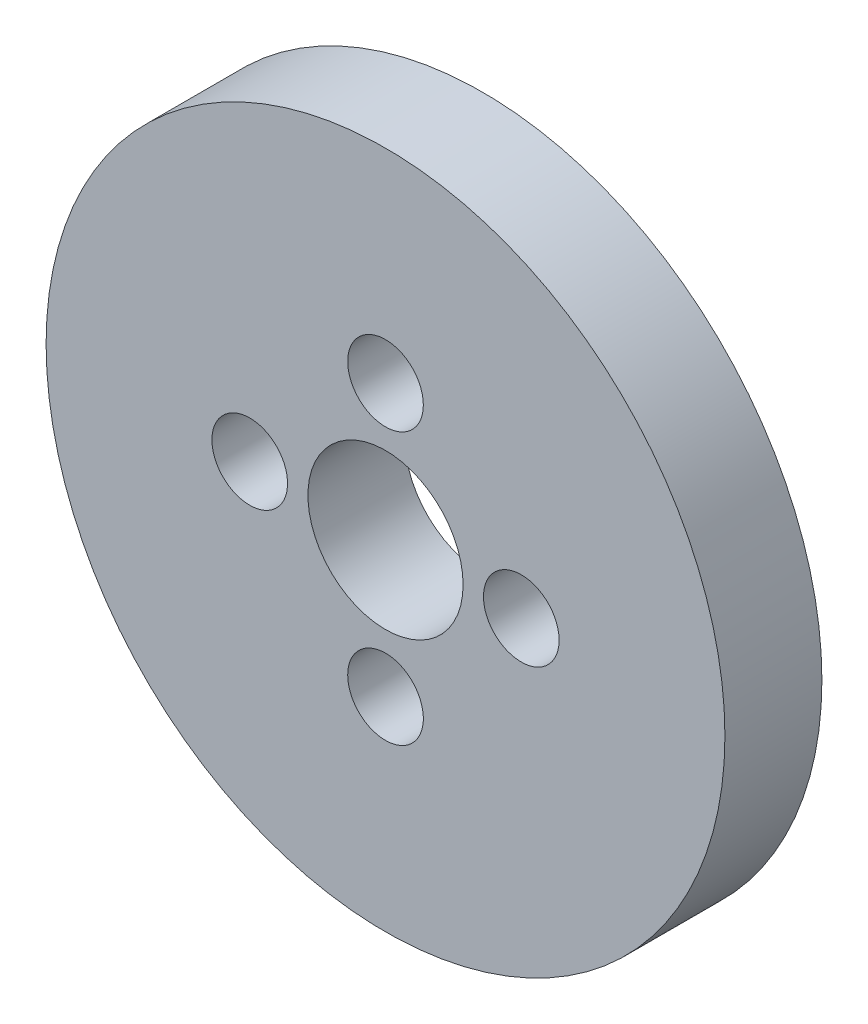
from build123d import *

# Parameters (mm, degrees)
SKETCH1_R           = 17.5
SKETCH1_R_2         = 4
SKETCH1_R_3         = 1.95
BOSS_EXTRUDE1_DEPTH = 5


with BuildPart() as part:
    # Sketch1 → Boss-Extrude1 (new body)
    with BuildSketch(Plane.XY):
        Circle(SKETCH1_R)
        Circle(SKETCH1_R_2, mode=Mode.SUBTRACT)
        with Locations((7, 0)):
            Circle(SKETCH1_R_3, mode=Mode.SUBTRACT)
        with Locations((0, 7)):
            Circle(SKETCH1_R_3, mode=Mode.SUBTRACT)
        with Locations(Location((0, -7, 0), (0, 0, 180))):
            Circle(SKETCH1_R_3, mode=Mode.SUBTRACT)
        with Locations(Location((-7, 0, 0), (0, 0, 180))):
            Circle(SKETCH1_R_3, mode=Mode.SUBTRACT)
    extrude(amount=BOSS_EXTRUDE1_DEPTH)


solid = part.part
